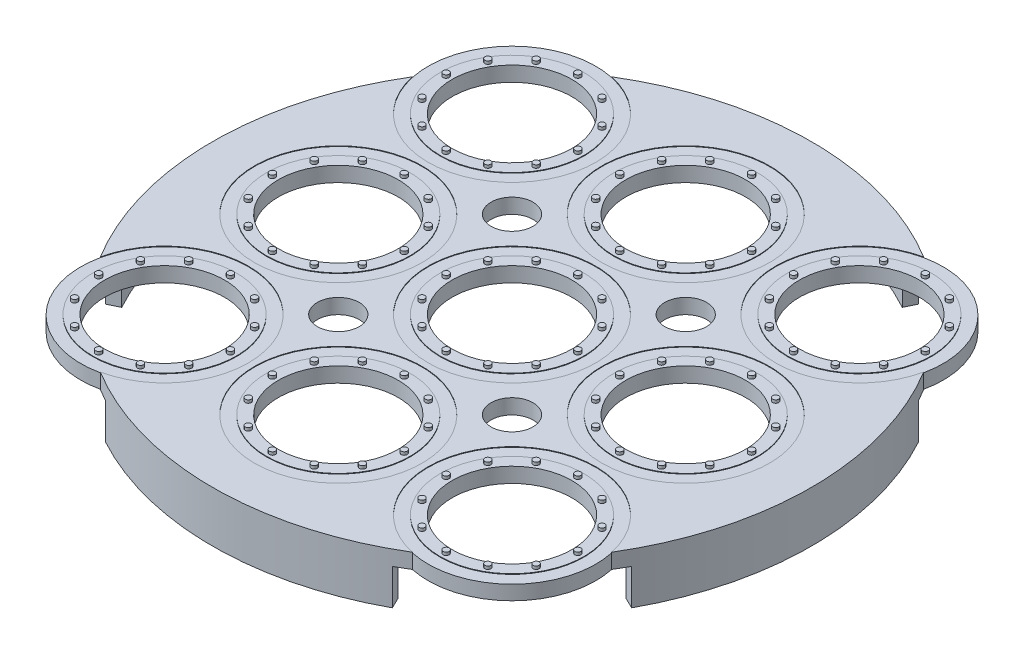
from build123d import *

# Parameters (mm, degrees)
BOSS_EXTRUDE1_DEPTH        = 2.5
SKETCH2_R                  = 10
CUT_EXTRUDE1_DEPTH         = 71.75485849
LPATTERN1_COUNT            = 3
LPATTERN1_PITCH            = 29
LPATTERN1_COUNT_DIR2       = 3
LPATTERN1_PITCH_DIR2       = 29
SKETCH4_R                  = 0.5
BOSS_EXTRUDE2_DEPTH        = 0.5
CIRPATTERN1_COUNT          = 12
LPATTERN2_COUNT            = 3
LPATTERN2_PITCH            = 29
LPATTERN2_COUNT_DIR2       = 3
LPATTERN2_PITCH_DIR2       = 29
LPATTERN2_COPY_1_SKETCH_R  = 0.5
LPATTERN2_COPY_1_DEPTH     = 0.5
LPATTERN2_COPY_2_SKETCH_R  = 0.5
LPATTERN2_COPY_2_DEPTH     = 0.5
LPATTERN2_COPY_3_SKETCH_R  = 0.5
LPATTERN2_COPY_3_DEPTH     = 0.5
LPATTERN2_COPY_4_SKETCH_R  = 0.5
LPATTERN2_COPY_4_DEPTH     = 0.5
LPATTERN2_COPY_5_SKETCH_R  = 0.5
LPATTERN2_COPY_5_DEPTH     = 0.5
LPATTERN2_COPY_6_SKETCH_R  = 0.5
LPATTERN2_COPY_6_DEPTH     = 0.5
LPATTERN2_COPY_7_SKETCH_R  = 0.5
LPATTERN2_COPY_7_DEPTH     = 0.5
LPATTERN2_COPY_8_SKETCH_R  = 0.5
LPATTERN2_COPY_8_DEPTH     = 0.5
LPATTERN2_COPY_9_SKETCH_R  = 0.5
LPATTERN2_COPY_9_DEPTH     = 0.5
LPATTERN2_COPY_10_SKETCH_R = 0.5
LPATTERN2_COPY_10_DEPTH    = 0.5
LPATTERN2_COPY_11_SKETCH_R = 0.5
LPATTERN2_COPY_11_DEPTH    = 0.5
LPATTERN2_COPY_12_SKETCH_R = 0.5
LPATTERN2_COPY_12_DEPTH    = 0.5
LPATTERN2_COPY_13_SKETCH_R = 0.5
LPATTERN2_COPY_13_DEPTH    = 0.5
LPATTERN2_COPY_14_SKETCH_R = 0.5
LPATTERN2_COPY_14_DEPTH    = 0.5
LPATTERN2_COPY_15_SKETCH_R = 0.5
LPATTERN2_COPY_15_DEPTH    = 0.5
LPATTERN2_COPY_16_SKETCH_R = 0.5
LPATTERN2_COPY_16_DEPTH    = 0.5
LPATTERN2_COPY_17_SKETCH_R = 0.5
LPATTERN2_COPY_17_DEPTH    = 0.5
LPATTERN2_COPY_18_SKETCH_R = 0.5
LPATTERN2_COPY_18_DEPTH    = 0.5
LPATTERN2_COPY_19_SKETCH_R = 0.5
LPATTERN2_COPY_19_DEPTH    = 0.5
LPATTERN2_COPY_20_SKETCH_R = 0.5
LPATTERN2_COPY_20_DEPTH    = 0.5
LPATTERN2_COPY_21_SKETCH_R = 0.5
LPATTERN2_COPY_21_DEPTH    = 0.5
LPATTERN2_COPY_22_SKETCH_R = 0.5
LPATTERN2_COPY_22_DEPTH    = 0.5
LPATTERN2_COPY_23_SKETCH_R = 0.5
LPATTERN2_COPY_23_DEPTH    = 0.5
LPATTERN2_COPY_24_SKETCH_R = 0.5
LPATTERN2_COPY_24_DEPTH    = 0.5
LPATTERN2_COPY_25_SKETCH_R = 0.5
LPATTERN2_COPY_25_DEPTH    = 0.5
LPATTERN2_COPY_26_SKETCH_R = 0.5
LPATTERN2_COPY_26_DEPTH    = 0.5
LPATTERN2_COPY_27_SKETCH_R = 0.5
LPATTERN2_COPY_27_DEPTH    = 0.5
LPATTERN2_COPY_28_SKETCH_R = 0.5
LPATTERN2_COPY_28_DEPTH    = 0.5
LPATTERN2_COPY_29_SKETCH_R = 0.5
LPATTERN2_COPY_29_DEPTH    = 0.5
LPATTERN2_COPY_30_SKETCH_R = 0.5
LPATTERN2_COPY_30_DEPTH    = 0.5
LPATTERN2_COPY_31_SKETCH_R = 0.5
LPATTERN2_COPY_31_DEPTH    = 0.5
LPATTERN2_COPY_32_SKETCH_R = 0.5
LPATTERN2_COPY_32_DEPTH    = 0.5
LPATTERN2_COPY_33_SKETCH_R = 0.5
LPATTERN2_COPY_33_DEPTH    = 0.5
LPATTERN2_COPY_34_SKETCH_R = 0.5
LPATTERN2_COPY_34_DEPTH    = 0.5
LPATTERN2_COPY_35_SKETCH_R = 0.5
LPATTERN2_COPY_35_DEPTH    = 0.5
LPATTERN2_COPY_36_SKETCH_R = 0.5
LPATTERN2_COPY_36_DEPTH    = 0.5
LPATTERN2_COPY_37_SKETCH_R = 0.5
LPATTERN2_COPY_37_DEPTH    = 0.5
LPATTERN2_COPY_38_SKETCH_R = 0.5
LPATTERN2_COPY_38_DEPTH    = 0.5
LPATTERN2_COPY_39_SKETCH_R = 0.5
LPATTERN2_COPY_39_DEPTH    = 0.5
LPATTERN2_COPY_40_SKETCH_R = 0.5
LPATTERN2_COPY_40_DEPTH    = 0.5
LPATTERN2_COPY_41_SKETCH_R = 0.5
LPATTERN2_COPY_41_DEPTH    = 0.5
LPATTERN2_COPY_42_SKETCH_R = 0.5
LPATTERN2_COPY_42_DEPTH    = 0.5
LPATTERN2_COPY_43_SKETCH_R = 0.5
LPATTERN2_COPY_43_DEPTH    = 0.5
LPATTERN2_COPY_44_SKETCH_R = 0.5
LPATTERN2_COPY_44_DEPTH    = 0.5
LPATTERN2_COPY_45_SKETCH_R = 0.5
LPATTERN2_COPY_45_DEPTH    = 0.5
LPATTERN2_COPY_46_SKETCH_R = 0.5
LPATTERN2_COPY_46_DEPTH    = 0.5
LPATTERN2_COPY_47_SKETCH_R = 0.5
LPATTERN2_COPY_47_DEPTH    = 0.5
LPATTERN2_COPY_48_SKETCH_R = 0.5
LPATTERN2_COPY_48_DEPTH    = 0.5
LPATTERN2_COPY_49_SKETCH_R = 0.5
LPATTERN2_COPY_49_DEPTH    = 0.5
LPATTERN2_COPY_50_SKETCH_R = 0.5
LPATTERN2_COPY_50_DEPTH    = 0.5
LPATTERN2_COPY_51_SKETCH_R = 0.5
LPATTERN2_COPY_51_DEPTH    = 0.5
LPATTERN2_COPY_52_SKETCH_R = 0.5
LPATTERN2_COPY_52_DEPTH    = 0.5
LPATTERN2_COPY_53_SKETCH_R = 0.5
LPATTERN2_COPY_53_DEPTH    = 0.5
LPATTERN2_COPY_54_SKETCH_R = 0.5
LPATTERN2_COPY_54_DEPTH    = 0.5
LPATTERN2_COPY_55_SKETCH_R = 0.5
LPATTERN2_COPY_55_DEPTH    = 0.5
LPATTERN2_COPY_56_SKETCH_R = 0.5
LPATTERN2_COPY_56_DEPTH    = 0.5
LPATTERN2_COPY_57_SKETCH_R = 0.5
LPATTERN2_COPY_57_DEPTH    = 0.5
LPATTERN2_COPY_58_SKETCH_R = 0.5
LPATTERN2_COPY_58_DEPTH    = 0.5
LPATTERN2_COPY_59_SKETCH_R = 0.5
LPATTERN2_COPY_59_DEPTH    = 0.5
LPATTERN2_COPY_60_SKETCH_R = 0.5
LPATTERN2_COPY_60_DEPTH    = 0.5
LPATTERN2_COPY_61_SKETCH_R = 0.5
LPATTERN2_COPY_61_DEPTH    = 0.5
LPATTERN2_COPY_62_SKETCH_R = 0.5
LPATTERN2_COPY_62_DEPTH    = 0.5
LPATTERN2_COPY_63_SKETCH_R = 0.5
LPATTERN2_COPY_63_DEPTH    = 0.5
LPATTERN2_COPY_64_SKETCH_R = 0.5
LPATTERN2_COPY_64_DEPTH    = 0.5
LPATTERN2_COPY_65_SKETCH_R = 0.5
LPATTERN2_COPY_65_DEPTH    = 0.5
LPATTERN2_COPY_66_SKETCH_R = 0.5
LPATTERN2_COPY_66_DEPTH    = 0.5
LPATTERN2_COPY_67_SKETCH_R = 0.5
LPATTERN2_COPY_67_DEPTH    = 0.5
LPATTERN2_COPY_68_SKETCH_R = 0.5
LPATTERN2_COPY_68_DEPTH    = 0.5
LPATTERN2_COPY_69_SKETCH_R = 0.5
LPATTERN2_COPY_69_DEPTH    = 0.5
LPATTERN2_COPY_70_SKETCH_R = 0.5
LPATTERN2_COPY_70_DEPTH    = 0.5
LPATTERN2_COPY_71_SKETCH_R = 0.5
LPATTERN2_COPY_71_DEPTH    = 0.5
LPATTERN2_COPY_72_SKETCH_R = 0.5
LPATTERN2_COPY_72_DEPTH    = 0.5
LPATTERN2_COPY_73_SKETCH_R = 0.5
LPATTERN2_COPY_73_DEPTH    = 0.5
LPATTERN2_COPY_74_SKETCH_R = 0.5
LPATTERN2_COPY_74_DEPTH    = 0.5
LPATTERN2_COPY_75_SKETCH_R = 0.5
LPATTERN2_COPY_75_DEPTH    = 0.5
LPATTERN2_COPY_76_SKETCH_R = 0.5
LPATTERN2_COPY_76_DEPTH    = 0.5
LPATTERN2_COPY_77_SKETCH_R = 0.5
LPATTERN2_COPY_77_DEPTH    = 0.5
LPATTERN2_COPY_78_SKETCH_R = 0.5
LPATTERN2_COPY_78_DEPTH    = 0.5
LPATTERN2_COPY_79_SKETCH_R = 0.5
LPATTERN2_COPY_79_DEPTH    = 0.5
LPATTERN2_COPY_80_SKETCH_R = 0.5
LPATTERN2_COPY_80_DEPTH    = 0.5
LPATTERN2_COPY_81_SKETCH_R = 0.5
LPATTERN2_COPY_81_DEPTH    = 0.5
LPATTERN2_COPY_82_SKETCH_R = 0.5
LPATTERN2_COPY_82_DEPTH    = 0.5
LPATTERN2_COPY_83_SKETCH_R = 0.5
LPATTERN2_COPY_83_DEPTH    = 0.5
LPATTERN2_COPY_84_SKETCH_R = 0.5
LPATTERN2_COPY_84_DEPTH    = 0.5
LPATTERN2_COPY_85_SKETCH_R = 0.5
LPATTERN2_COPY_85_DEPTH    = 0.5
LPATTERN2_COPY_86_SKETCH_R = 0.5
LPATTERN2_COPY_86_DEPTH    = 0.5
LPATTERN2_COPY_87_SKETCH_R = 0.5
LPATTERN2_COPY_87_DEPTH    = 0.5
LPATTERN2_COPY_88_SKETCH_R = 0.5
LPATTERN2_COPY_88_DEPTH    = 0.5
SKETCH5_R                  = 3.5
CUT_EXTRUDE2_DEPTH         = 71.75485849
MIRROR2_COPY_1_SKETCH_R    = 3.5
MIRROR2_COPY_1_DEPTH       = 71.75485849
BOSS_EXTRUDE3_START        = 6
BOSS_EXTRUDE3_DEPTH        = 6
CIRPATTERN2_COUNT          = 4
CUT_EXTRUDE3_START         = -0.1
SKETCH7_R                  = 14
SKETCH7_R_2                = 12
CUT_EXTRUDE3_DEPTH         = 0.1
LPATTERN3_COUNT            = 3
LPATTERN3_PITCH            = 29
LPATTERN3_COUNT_DIR2       = 3
LPATTERN3_PITCH_DIR2       = 29


with BuildPart() as part:
    # Sketch1 → Boss-Extrude1 (new body)
    with BuildSketch(Plane(origin=(0, 0, 0), x_dir=(1, 0, 0), z_dir=(0, 1, 0))):
        with BuildLine():
            ThreePointArc((26.040517643, 42.683620288), (0, 50), (-26.040517643, 42.683620288))
            ThreePointArc((-26.040517643, 42.683620288), (-38.899494937, 38.899494937), (-42.683620288, 26.040517643))
            ThreePointArc((-42.683620288, 26.040517643), (-50, 0), (-42.683620288, -26.040517643))
            ThreePointArc((-42.683620288, -26.040517643), (-38.899494937, -38.899494937), (-26.040517643, -42.683620288))
            ThreePointArc((-26.040517643, -42.683620288), (0, -50), (26.040517643, -42.683620288))
            ThreePointArc((26.040517643, -42.683620288), (38.899494937, -38.899494937), (42.683620288, -26.040517643))
            ThreePointArc((42.683620288, -26.040517643), (50, 0), (42.683620288, 26.040517643))
            ThreePointArc((42.683620288, 26.040517643), (38.899494937, 38.899494937), (26.040517643, 42.683620288))
        make_face()
    extrude(amount=BOSS_EXTRUDE1_DEPTH)

    # Sketch2 → Cut-Extrude1 (cut, through all)
    with BuildSketch(Plane(origin=(0, 2.5, 0), x_dir=(1, 0, 0), z_dir=(0, 1, 0))):
        with Locations(Location((-29, -29, 0), (0, 0, 270))):
            Circle(SKETCH2_R)
    cut_extrude1 = extrude(amount=-CUT_EXTRUDE1_DEPTH, mode=Mode.SUBTRACT)

    # LPattern1: Cut-Extrude1 3 × 3
    with Locations(*[(i * LPATTERN1_PITCH, 0, -j * LPATTERN1_PITCH_DIR2) for i in range(LPATTERN1_COUNT) for j in range(LPATTERN1_COUNT_DIR2) if (i, j) != (0, 0)]):
        add(cut_extrude1, mode=Mode.SUBTRACT)

    # Sketch4 → Boss-Extrude2 (add)
    with BuildSketch(Plane(origin=(0, 2.5, 0), x_dir=(1, 0, 0), z_dir=(0, 1, 0))):
        with Locations(Location((-29, -18, 0), (0, 0, 270))):
            Circle(SKETCH4_R)
    boss_extrude2 = extrude(amount=BOSS_EXTRUDE2_DEPTH)

    # CirPattern1: Boss-Extrude2 ×12 about axis
    cirpattern1_axis = Axis((-29, 0, 29), (0, 1, 0))
    for i in range(1, CIRPATTERN1_COUNT):
        add(boss_extrude2.rotate(cirpattern1_axis, i * 360 / CIRPATTERN1_COUNT))

    # LPattern2: Boss-Extrude2 3 × 3
    with Locations(*[(j * LPATTERN2_PITCH_DIR2, 0, -i * LPATTERN2_PITCH) for i in range(LPATTERN2_COUNT) for j in range(LPATTERN2_COUNT_DIR2) if (i, j) != (0, 0)]):
        add(boss_extrude2)

    # LPattern2 copy 1 sketch → LPattern2 copy 1 (add)
    with BuildSketch(Plane(origin=(10.61473671, 2.5, -10.61473671), x_dir=(0.8660254037844387, 0, -0.49999999999999994), z_dir=(0, 1, 0))):
        with Locations(Location((-29, -18, 0), (0, 0, 270))):
            Circle(LPATTERN2_COPY_1_SKETCH_R)
    extrude(amount=LPATTERN2_COPY_1_DEPTH)

    # LPattern2 copy 2 sketch → LPattern2 copy 2 (add)
    with BuildSketch(Plane(origin=(39.61473671, 2.5, -10.61473671), x_dir=(0.8660254037844387, 0, -0.49999999999999994), z_dir=(0, 1, 0))):
        with Locations(Location((-29, -18, 0), (0, 0, 270))):
            Circle(LPATTERN2_COPY_2_SKETCH_R)
    extrude(amount=LPATTERN2_COPY_2_DEPTH)

    # LPattern2 copy 3 sketch → LPattern2 copy 3 (add)
    with BuildSketch(Plane(origin=(-18.38526329, 2.5, -39.61473671), x_dir=(0.8660254037844387, 0, -0.49999999999999994), z_dir=(0, 1, 0))):
        with Locations(Location((-29, -18, 0), (0, 0, 270))):
            Circle(LPATTERN2_COPY_3_SKETCH_R)
    extrude(amount=LPATTERN2_COPY_3_DEPTH)

    # LPattern2 copy 4 sketch → LPattern2 copy 4 (add)
    with BuildSketch(Plane(origin=(10.61473671, 2.5, -39.61473671), x_dir=(0.8660254037844387, 0, -0.49999999999999994), z_dir=(0, 1, 0))):
        with Locations(Location((-29, -18, 0), (0, 0, 270))):
            Circle(LPATTERN2_COPY_4_SKETCH_R)
    extrude(amount=LPATTERN2_COPY_4_DEPTH)

    # LPattern2 copy 5 sketch → LPattern2 copy 5 (add)
    with BuildSketch(Plane(origin=(39.61473671, 2.5, -39.61473671), x_dir=(0.8660254037844387, 0, -0.49999999999999994), z_dir=(0, 1, 0))):
        with Locations(Location((-29, -18, 0), (0, 0, 270))):
            Circle(LPATTERN2_COPY_5_SKETCH_R)
    extrude(amount=LPATTERN2_COPY_5_DEPTH)

    # LPattern2 copy 6 sketch → LPattern2 copy 6 (add)
    with BuildSketch(Plane(origin=(-18.38526329, 2.5, -68.61473671), x_dir=(0.8660254037844387, 0, -0.49999999999999994), z_dir=(0, 1, 0))):
        with Locations(Location((-29, -18, 0), (0, 0, 270))):
            Circle(LPATTERN2_COPY_6_SKETCH_R)
    extrude(amount=LPATTERN2_COPY_6_DEPTH)

    # LPattern2 copy 7 sketch → LPattern2 copy 7 (add)
    with BuildSketch(Plane(origin=(10.61473671, 2.5, -68.61473671), x_dir=(0.8660254037844387, 0, -0.49999999999999994), z_dir=(0, 1, 0))):
        with Locations(Location((-29, -18, 0), (0, 0, 270))):
            Circle(LPATTERN2_COPY_7_SKETCH_R)
    extrude(amount=LPATTERN2_COPY_7_DEPTH)

    # LPattern2 copy 8 sketch → LPattern2 copy 8 (add)
    with BuildSketch(Plane(origin=(39.61473671, 2.5, -68.61473671), x_dir=(0.8660254037844387, 0, -0.49999999999999994), z_dir=(0, 1, 0))):
        with Locations(Location((-29, -18, 0), (0, 0, 270))):
            Circle(LPATTERN2_COPY_8_SKETCH_R)
    extrude(amount=LPATTERN2_COPY_8_DEPTH)

    # LPattern2 copy 9 sketch → LPattern2 copy 9 (add)
    with BuildSketch(Plane(origin=(-10.61473671, 2.5, -10.61473671), x_dir=(0.5000000000000001, 0, -0.8660254037844386), z_dir=(0, 1, 0))):
        with Locations(Location((-29, -18, 0), (0, 0, 270))):
            Circle(LPATTERN2_COPY_9_SKETCH_R)
    extrude(amount=LPATTERN2_COPY_9_DEPTH)

    # LPattern2 copy 10 sketch → LPattern2 copy 10 (add)
    with BuildSketch(Plane(origin=(18.38526329, 2.5, -10.61473671), x_dir=(0.5000000000000001, 0, -0.8660254037844386), z_dir=(0, 1, 0))):
        with Locations(Location((-29, -18, 0), (0, 0, 270))):
            Circle(LPATTERN2_COPY_10_SKETCH_R)
    extrude(amount=LPATTERN2_COPY_10_DEPTH)

    # LPattern2 copy 11 sketch → LPattern2 copy 11 (add)
    with BuildSketch(Plane(origin=(-39.61473671, 2.5, -39.61473671), x_dir=(0.5000000000000001, 0, -0.8660254037844386), z_dir=(0, 1, 0))):
        with Locations(Location((-29, -18, 0), (0, 0, 270))):
            Circle(LPATTERN2_COPY_11_SKETCH_R)
    extrude(amount=LPATTERN2_COPY_11_DEPTH)

    # LPattern2 copy 12 sketch → LPattern2 copy 12 (add)
    with BuildSketch(Plane(origin=(-10.61473671, 2.5, -39.61473671), x_dir=(0.5000000000000001, 0, -0.8660254037844386), z_dir=(0, 1, 0))):
        with Locations(Location((-29, -18, 0), (0, 0, 270))):
            Circle(LPATTERN2_COPY_12_SKETCH_R)
    extrude(amount=LPATTERN2_COPY_12_DEPTH)

    # LPattern2 copy 13 sketch → LPattern2 copy 13 (add)
    with BuildSketch(Plane(origin=(18.38526329, 2.5, -39.61473671), x_dir=(0.5000000000000001, 0, -0.8660254037844386), z_dir=(0, 1, 0))):
        with Locations(Location((-29, -18, 0), (0, 0, 270))):
            Circle(LPATTERN2_COPY_13_SKETCH_R)
    extrude(amount=LPATTERN2_COPY_13_DEPTH)

    # LPattern2 copy 14 sketch → LPattern2 copy 14 (add)
    with BuildSketch(Plane(origin=(-39.61473671, 2.5, -68.61473671), x_dir=(0.5000000000000001, 0, -0.8660254037844386), z_dir=(0, 1, 0))):
        with Locations(Location((-29, -18, 0), (0, 0, 270))):
            Circle(LPATTERN2_COPY_14_SKETCH_R)
    extrude(amount=LPATTERN2_COPY_14_DEPTH)

    # LPattern2 copy 15 sketch → LPattern2 copy 15 (add)
    with BuildSketch(Plane(origin=(-10.61473671, 2.5, -68.61473671), x_dir=(0.5000000000000001, 0, -0.8660254037844386), z_dir=(0, 1, 0))):
        with Locations(Location((-29, -18, 0), (0, 0, 270))):
            Circle(LPATTERN2_COPY_15_SKETCH_R)
    extrude(amount=LPATTERN2_COPY_15_DEPTH)

    # LPattern2 copy 16 sketch → LPattern2 copy 16 (add)
    with BuildSketch(Plane(origin=(18.38526329, 2.5, -68.61473671), x_dir=(0.5000000000000001, 0, -0.8660254037844386), z_dir=(0, 1, 0))):
        with Locations(Location((-29, -18, 0), (0, 0, 270))):
            Circle(LPATTERN2_COPY_16_SKETCH_R)
    extrude(amount=LPATTERN2_COPY_16_DEPTH)

    # LPattern2 copy 17 sketch → LPattern2 copy 17 (add)
    with BuildSketch(Plane(origin=(-29, 2.5, 0), x_dir=(0, 0, -1), z_dir=(0, 1, 0))):
        with Locations(Location((-29, -18, 0), (0, 0, 270))):
            Circle(LPATTERN2_COPY_17_SKETCH_R)
    extrude(amount=LPATTERN2_COPY_17_DEPTH)

    # LPattern2 copy 18 sketch → LPattern2 copy 18 (add)
    with BuildSketch(Plane(origin=(0, 2.5, 0), x_dir=(0, 0, -1), z_dir=(0, 1, 0))):
        with Locations(Location((-29, -18, 0), (0, 0, 270))):
            Circle(LPATTERN2_COPY_18_SKETCH_R)
    extrude(amount=LPATTERN2_COPY_18_DEPTH)

    # LPattern2 copy 19 sketch → LPattern2 copy 19 (add)
    with BuildSketch(Plane(origin=(-58, 2.5, -29), x_dir=(0, 0, -1), z_dir=(0, 1, 0))):
        with Locations(Location((-29, -18, 0), (0, 0, 270))):
            Circle(LPATTERN2_COPY_19_SKETCH_R)
    extrude(amount=LPATTERN2_COPY_19_DEPTH)

    # LPattern2 copy 20 sketch → LPattern2 copy 20 (add)
    with BuildSketch(Plane(origin=(-29, 2.5, -29), x_dir=(0, 0, -1), z_dir=(0, 1, 0))):
        with Locations(Location((-29, -18, 0), (0, 0, 270))):
            Circle(LPATTERN2_COPY_20_SKETCH_R)
    extrude(amount=LPATTERN2_COPY_20_DEPTH)

    # LPattern2 copy 21 sketch → LPattern2 copy 21 (add)
    with BuildSketch(Plane(origin=(0, 2.5, -29), x_dir=(0, 0, -1), z_dir=(0, 1, 0))):
        with Locations(Location((-29, -18, 0), (0, 0, 270))):
            Circle(LPATTERN2_COPY_21_SKETCH_R)
    extrude(amount=LPATTERN2_COPY_21_DEPTH)

    # LPattern2 copy 22 sketch → LPattern2 copy 22 (add)
    with BuildSketch(Plane(origin=(-58, 2.5, -58), x_dir=(0, 0, -1), z_dir=(0, 1, 0))):
        with Locations(Location((-29, -18, 0), (0, 0, 270))):
            Circle(LPATTERN2_COPY_22_SKETCH_R)
    extrude(amount=LPATTERN2_COPY_22_DEPTH)

    # LPattern2 copy 23 sketch → LPattern2 copy 23 (add)
    with BuildSketch(Plane(origin=(-29, 2.5, -58), x_dir=(0, 0, -1), z_dir=(0, 1, 0))):
        with Locations(Location((-29, -18, 0), (0, 0, 270))):
            Circle(LPATTERN2_COPY_23_SKETCH_R)
    extrude(amount=LPATTERN2_COPY_23_DEPTH)

    # LPattern2 copy 24 sketch → LPattern2 copy 24 (add)
    with BuildSketch(Plane(origin=(0, 2.5, -58), x_dir=(0, 0, -1), z_dir=(0, 1, 0))):
        with Locations(Location((-29, -18, 0), (0, 0, 270))):
            Circle(LPATTERN2_COPY_24_SKETCH_R)
    extrude(amount=LPATTERN2_COPY_24_DEPTH)

    # LPattern2 copy 25 sketch → LPattern2 copy 25 (add)
    with BuildSketch(Plane(origin=(-39.61473671, 2.5, 18.38526329), x_dir=(-0.4999999999999998, 0, -0.8660254037844387), z_dir=(0, 1, 0))):
        with Locations(Location((-29, -18, 0), (0, 0, 270))):
            Circle(LPATTERN2_COPY_25_SKETCH_R)
    extrude(amount=LPATTERN2_COPY_25_DEPTH)

    # LPattern2 copy 26 sketch → LPattern2 copy 26 (add)
    with BuildSketch(Plane(origin=(-10.61473671, 2.5, 18.38526329), x_dir=(-0.4999999999999998, 0, -0.8660254037844387), z_dir=(0, 1, 0))):
        with Locations(Location((-29, -18, 0), (0, 0, 270))):
            Circle(LPATTERN2_COPY_26_SKETCH_R)
    extrude(amount=LPATTERN2_COPY_26_DEPTH)

    # LPattern2 copy 27 sketch → LPattern2 copy 27 (add)
    with BuildSketch(Plane(origin=(-68.61473671, 2.5, -10.61473671), x_dir=(-0.4999999999999998, 0, -0.8660254037844387), z_dir=(0, 1, 0))):
        with Locations(Location((-29, -18, 0), (0, 0, 270))):
            Circle(LPATTERN2_COPY_27_SKETCH_R)
    extrude(amount=LPATTERN2_COPY_27_DEPTH)

    # LPattern2 copy 28 sketch → LPattern2 copy 28 (add)
    with BuildSketch(Plane(origin=(-39.61473671, 2.5, -10.61473671), x_dir=(-0.4999999999999998, 0, -0.8660254037844387), z_dir=(0, 1, 0))):
        with Locations(Location((-29, -18, 0), (0, 0, 270))):
            Circle(LPATTERN2_COPY_28_SKETCH_R)
    extrude(amount=LPATTERN2_COPY_28_DEPTH)

    # LPattern2 copy 29 sketch → LPattern2 copy 29 (add)
    with BuildSketch(Plane(origin=(-10.61473671, 2.5, -10.61473671), x_dir=(-0.4999999999999998, 0, -0.8660254037844387), z_dir=(0, 1, 0))):
        with Locations(Location((-29, -18, 0), (0, 0, 270))):
            Circle(LPATTERN2_COPY_29_SKETCH_R)
    extrude(amount=LPATTERN2_COPY_29_DEPTH)

    # LPattern2 copy 30 sketch → LPattern2 copy 30 (add)
    with BuildSketch(Plane(origin=(-68.61473671, 2.5, -39.61473671), x_dir=(-0.4999999999999998, 0, -0.8660254037844387), z_dir=(0, 1, 0))):
        with Locations(Location((-29, -18, 0), (0, 0, 270))):
            Circle(LPATTERN2_COPY_30_SKETCH_R)
    extrude(amount=LPATTERN2_COPY_30_DEPTH)

    # LPattern2 copy 31 sketch → LPattern2 copy 31 (add)
    with BuildSketch(Plane(origin=(-39.61473671, 2.5, -39.61473671), x_dir=(-0.4999999999999998, 0, -0.8660254037844387), z_dir=(0, 1, 0))):
        with Locations(Location((-29, -18, 0), (0, 0, 270))):
            Circle(LPATTERN2_COPY_31_SKETCH_R)
    extrude(amount=LPATTERN2_COPY_31_DEPTH)

    # LPattern2 copy 32 sketch → LPattern2 copy 32 (add)
    with BuildSketch(Plane(origin=(-10.61473671, 2.5, -39.61473671), x_dir=(-0.4999999999999998, 0, -0.8660254037844387), z_dir=(0, 1, 0))):
        with Locations(Location((-29, -18, 0), (0, 0, 270))):
            Circle(LPATTERN2_COPY_32_SKETCH_R)
    extrude(amount=LPATTERN2_COPY_32_DEPTH)

    # LPattern2 copy 33 sketch → LPattern2 copy 33 (add)
    with BuildSketch(Plane(origin=(-39.61473671, 2.5, 39.61473671), x_dir=(-0.8660254037844387, 0, -0.49999999999999994), z_dir=(0, 1, 0))):
        with Locations(Location((-29, -18, 0), (0, 0, 270))):
            Circle(LPATTERN2_COPY_33_SKETCH_R)
    extrude(amount=LPATTERN2_COPY_33_DEPTH)

    # LPattern2 copy 34 sketch → LPattern2 copy 34 (add)
    with BuildSketch(Plane(origin=(-10.61473671, 2.5, 39.61473671), x_dir=(-0.8660254037844387, 0, -0.49999999999999994), z_dir=(0, 1, 0))):
        with Locations(Location((-29, -18, 0), (0, 0, 270))):
            Circle(LPATTERN2_COPY_34_SKETCH_R)
    extrude(amount=LPATTERN2_COPY_34_DEPTH)

    # LPattern2 copy 35 sketch → LPattern2 copy 35 (add)
    with BuildSketch(Plane(origin=(-68.61473671, 2.5, 10.61473671), x_dir=(-0.8660254037844387, 0, -0.49999999999999994), z_dir=(0, 1, 0))):
        with Locations(Location((-29, -18, 0), (0, 0, 270))):
            Circle(LPATTERN2_COPY_35_SKETCH_R)
    extrude(amount=LPATTERN2_COPY_35_DEPTH)

    # LPattern2 copy 36 sketch → LPattern2 copy 36 (add)
    with BuildSketch(Plane(origin=(-39.61473671, 2.5, 10.61473671), x_dir=(-0.8660254037844387, 0, -0.49999999999999994), z_dir=(0, 1, 0))):
        with Locations(Location((-29, -18, 0), (0, 0, 270))):
            Circle(LPATTERN2_COPY_36_SKETCH_R)
    extrude(amount=LPATTERN2_COPY_36_DEPTH)

    # LPattern2 copy 37 sketch → LPattern2 copy 37 (add)
    with BuildSketch(Plane(origin=(-10.61473671, 2.5, 10.61473671), x_dir=(-0.8660254037844387, 0, -0.49999999999999994), z_dir=(0, 1, 0))):
        with Locations(Location((-29, -18, 0), (0, 0, 270))):
            Circle(LPATTERN2_COPY_37_SKETCH_R)
    extrude(amount=LPATTERN2_COPY_37_DEPTH)

    # LPattern2 copy 38 sketch → LPattern2 copy 38 (add)
    with BuildSketch(Plane(origin=(-68.61473671, 2.5, -18.38526329), x_dir=(-0.8660254037844387, 0, -0.49999999999999994), z_dir=(0, 1, 0))):
        with Locations(Location((-29, -18, 0), (0, 0, 270))):
            Circle(LPATTERN2_COPY_38_SKETCH_R)
    extrude(amount=LPATTERN2_COPY_38_DEPTH)

    # LPattern2 copy 39 sketch → LPattern2 copy 39 (add)
    with BuildSketch(Plane(origin=(-39.61473671, 2.5, -18.38526329), x_dir=(-0.8660254037844387, 0, -0.49999999999999994), z_dir=(0, 1, 0))):
        with Locations(Location((-29, -18, 0), (0, 0, 270))):
            Circle(LPATTERN2_COPY_39_SKETCH_R)
    extrude(amount=LPATTERN2_COPY_39_DEPTH)

    # LPattern2 copy 40 sketch → LPattern2 copy 40 (add)
    with BuildSketch(Plane(origin=(-10.61473671, 2.5, -18.38526329), x_dir=(-0.8660254037844387, 0, -0.49999999999999994), z_dir=(0, 1, 0))):
        with Locations(Location((-29, -18, 0), (0, 0, 270))):
            Circle(LPATTERN2_COPY_40_SKETCH_R)
    extrude(amount=LPATTERN2_COPY_40_DEPTH)

    # LPattern2 copy 41 sketch → LPattern2 copy 41 (add)
    with BuildSketch(Plane(origin=(-29, 2.5, 58), x_dir=(-1, 0, 0), z_dir=(0, 1, 0))):
        with Locations(Location((-29, -18, 0), (0, 0, 270))):
            Circle(LPATTERN2_COPY_41_SKETCH_R)
    extrude(amount=LPATTERN2_COPY_41_DEPTH)

    # LPattern2 copy 42 sketch → LPattern2 copy 42 (add)
    with BuildSketch(Plane(origin=(0, 2.5, 58), x_dir=(-1, 0, 0), z_dir=(0, 1, 0))):
        with Locations(Location((-29, -18, 0), (0, 0, 270))):
            Circle(LPATTERN2_COPY_42_SKETCH_R)
    extrude(amount=LPATTERN2_COPY_42_DEPTH)

    # LPattern2 copy 43 sketch → LPattern2 copy 43 (add)
    with BuildSketch(Plane(origin=(-58, 2.5, 29), x_dir=(-1, 0, 0), z_dir=(0, 1, 0))):
        with Locations(Location((-29, -18, 0), (0, 0, 270))):
            Circle(LPATTERN2_COPY_43_SKETCH_R)
    extrude(amount=LPATTERN2_COPY_43_DEPTH)

    # LPattern2 copy 44 sketch → LPattern2 copy 44 (add)
    with BuildSketch(Plane(origin=(-29, 2.5, 29), x_dir=(-1, 0, 0), z_dir=(0, 1, 0))):
        with Locations(Location((-29, -18, 0), (0, 0, 270))):
            Circle(LPATTERN2_COPY_44_SKETCH_R)
    extrude(amount=LPATTERN2_COPY_44_DEPTH)

    # LPattern2 copy 45 sketch → LPattern2 copy 45 (add)
    with BuildSketch(Plane(origin=(0, 2.5, 29), x_dir=(-1, 0, 0), z_dir=(0, 1, 0))):
        with Locations(Location((-29, -18, 0), (0, 0, 270))):
            Circle(LPATTERN2_COPY_45_SKETCH_R)
    extrude(amount=LPATTERN2_COPY_45_DEPTH)

    # LPattern2 copy 46 sketch → LPattern2 copy 46 (add)
    with BuildSketch(Plane(origin=(-58, 2.5, 0), x_dir=(-1, 0, 0), z_dir=(0, 1, 0))):
        with Locations(Location((-29, -18, 0), (0, 0, 270))):
            Circle(LPATTERN2_COPY_46_SKETCH_R)
    extrude(amount=LPATTERN2_COPY_46_DEPTH)

    # LPattern2 copy 47 sketch → LPattern2 copy 47 (add)
    with BuildSketch(Plane(origin=(-29, 2.5, 0), x_dir=(-1, 0, 0), z_dir=(0, 1, 0))):
        with Locations(Location((-29, -18, 0), (0, 0, 270))):
            Circle(LPATTERN2_COPY_47_SKETCH_R)
    extrude(amount=LPATTERN2_COPY_47_DEPTH)

    # LPattern2 copy 48 sketch → LPattern2 copy 48 (add)
    with BuildSketch(Plane(origin=(0, 2.5, 0), x_dir=(-1, 0, 0), z_dir=(0, 1, 0))):
        with Locations(Location((-29, -18, 0), (0, 0, 270))):
            Circle(LPATTERN2_COPY_48_SKETCH_R)
    extrude(amount=LPATTERN2_COPY_48_DEPTH)

    # LPattern2 copy 49 sketch → LPattern2 copy 49 (add)
    with BuildSketch(Plane(origin=(-10.61473671, 2.5, 68.61473671), x_dir=(-0.8660254037844386, 0, 0.5000000000000001), z_dir=(0, 1, 0))):
        with Locations(Location((-29, -18, 0), (0, 0, 270))):
            Circle(LPATTERN2_COPY_49_SKETCH_R)
    extrude(amount=LPATTERN2_COPY_49_DEPTH)

    # LPattern2 copy 50 sketch → LPattern2 copy 50 (add)
    with BuildSketch(Plane(origin=(18.38526329, 2.5, 68.61473671), x_dir=(-0.8660254037844386, 0, 0.5000000000000001), z_dir=(0, 1, 0))):
        with Locations(Location((-29, -18, 0), (0, 0, 270))):
            Circle(LPATTERN2_COPY_50_SKETCH_R)
    extrude(amount=LPATTERN2_COPY_50_DEPTH)

    # LPattern2 copy 51 sketch → LPattern2 copy 51 (add)
    with BuildSketch(Plane(origin=(-39.61473671, 2.5, 39.61473671), x_dir=(-0.8660254037844386, 0, 0.5000000000000001), z_dir=(0, 1, 0))):
        with Locations(Location((-29, -18, 0), (0, 0, 270))):
            Circle(LPATTERN2_COPY_51_SKETCH_R)
    extrude(amount=LPATTERN2_COPY_51_DEPTH)

    # LPattern2 copy 52 sketch → LPattern2 copy 52 (add)
    with BuildSketch(Plane(origin=(-10.61473671, 2.5, 39.61473671), x_dir=(-0.8660254037844386, 0, 0.5000000000000001), z_dir=(0, 1, 0))):
        with Locations(Location((-29, -18, 0), (0, 0, 270))):
            Circle(LPATTERN2_COPY_52_SKETCH_R)
    extrude(amount=LPATTERN2_COPY_52_DEPTH)

    # LPattern2 copy 53 sketch → LPattern2 copy 53 (add)
    with BuildSketch(Plane(origin=(18.38526329, 2.5, 39.61473671), x_dir=(-0.8660254037844386, 0, 0.5000000000000001), z_dir=(0, 1, 0))):
        with Locations(Location((-29, -18, 0), (0, 0, 270))):
            Circle(LPATTERN2_COPY_53_SKETCH_R)
    extrude(amount=LPATTERN2_COPY_53_DEPTH)

    # LPattern2 copy 54 sketch → LPattern2 copy 54 (add)
    with BuildSketch(Plane(origin=(-39.61473671, 2.5, 10.61473671), x_dir=(-0.8660254037844386, 0, 0.5000000000000001), z_dir=(0, 1, 0))):
        with Locations(Location((-29, -18, 0), (0, 0, 270))):
            Circle(LPATTERN2_COPY_54_SKETCH_R)
    extrude(amount=LPATTERN2_COPY_54_DEPTH)

    # LPattern2 copy 55 sketch → LPattern2 copy 55 (add)
    with BuildSketch(Plane(origin=(-10.61473671, 2.5, 10.61473671), x_dir=(-0.8660254037844386, 0, 0.5000000000000001), z_dir=(0, 1, 0))):
        with Locations(Location((-29, -18, 0), (0, 0, 270))):
            Circle(LPATTERN2_COPY_55_SKETCH_R)
    extrude(amount=LPATTERN2_COPY_55_DEPTH)

    # LPattern2 copy 56 sketch → LPattern2 copy 56 (add)
    with BuildSketch(Plane(origin=(18.38526329, 2.5, 10.61473671), x_dir=(-0.8660254037844386, 0, 0.5000000000000001), z_dir=(0, 1, 0))):
        with Locations(Location((-29, -18, 0), (0, 0, 270))):
            Circle(LPATTERN2_COPY_56_SKETCH_R)
    extrude(amount=LPATTERN2_COPY_56_DEPTH)

    # LPattern2 copy 57 sketch → LPattern2 copy 57 (add)
    with BuildSketch(Plane(origin=(10.61473671, 2.5, 68.61473671), x_dir=(-0.5000000000000004, 0, 0.8660254037844384), z_dir=(0, 1, 0))):
        with Locations(Location((-29, -18, 0), (0, 0, 270))):
            Circle(LPATTERN2_COPY_57_SKETCH_R)
    extrude(amount=LPATTERN2_COPY_57_DEPTH)

    # LPattern2 copy 58 sketch → LPattern2 copy 58 (add)
    with BuildSketch(Plane(origin=(39.61473671, 2.5, 68.61473671), x_dir=(-0.5000000000000004, 0, 0.8660254037844384), z_dir=(0, 1, 0))):
        with Locations(Location((-29, -18, 0), (0, 0, 270))):
            Circle(LPATTERN2_COPY_58_SKETCH_R)
    extrude(amount=LPATTERN2_COPY_58_DEPTH)

    # LPattern2 copy 59 sketch → LPattern2 copy 59 (add)
    with BuildSketch(Plane(origin=(-18.38526329, 2.5, 39.61473671), x_dir=(-0.5000000000000004, 0, 0.8660254037844384), z_dir=(0, 1, 0))):
        with Locations(Location((-29, -18, 0), (0, 0, 270))):
            Circle(LPATTERN2_COPY_59_SKETCH_R)
    extrude(amount=LPATTERN2_COPY_59_DEPTH)

    # LPattern2 copy 60 sketch → LPattern2 copy 60 (add)
    with BuildSketch(Plane(origin=(10.61473671, 2.5, 39.61473671), x_dir=(-0.5000000000000004, 0, 0.8660254037844384), z_dir=(0, 1, 0))):
        with Locations(Location((-29, -18, 0), (0, 0, 270))):
            Circle(LPATTERN2_COPY_60_SKETCH_R)
    extrude(amount=LPATTERN2_COPY_60_DEPTH)

    # LPattern2 copy 61 sketch → LPattern2 copy 61 (add)
    with BuildSketch(Plane(origin=(39.61473671, 2.5, 39.61473671), x_dir=(-0.5000000000000004, 0, 0.8660254037844384), z_dir=(0, 1, 0))):
        with Locations(Location((-29, -18, 0), (0, 0, 270))):
            Circle(LPATTERN2_COPY_61_SKETCH_R)
    extrude(amount=LPATTERN2_COPY_61_DEPTH)

    # LPattern2 copy 62 sketch → LPattern2 copy 62 (add)
    with BuildSketch(Plane(origin=(-18.38526329, 2.5, 10.61473671), x_dir=(-0.5000000000000004, 0, 0.8660254037844384), z_dir=(0, 1, 0))):
        with Locations(Location((-29, -18, 0), (0, 0, 270))):
            Circle(LPATTERN2_COPY_62_SKETCH_R)
    extrude(amount=LPATTERN2_COPY_62_DEPTH)

    # LPattern2 copy 63 sketch → LPattern2 copy 63 (add)
    with BuildSketch(Plane(origin=(10.61473671, 2.5, 10.61473671), x_dir=(-0.5000000000000004, 0, 0.8660254037844384), z_dir=(0, 1, 0))):
        with Locations(Location((-29, -18, 0), (0, 0, 270))):
            Circle(LPATTERN2_COPY_63_SKETCH_R)
    extrude(amount=LPATTERN2_COPY_63_DEPTH)

    # LPattern2 copy 64 sketch → LPattern2 copy 64 (add)
    with BuildSketch(Plane(origin=(39.61473671, 2.5, 10.61473671), x_dir=(-0.5000000000000004, 0, 0.8660254037844384), z_dir=(0, 1, 0))):
        with Locations(Location((-29, -18, 0), (0, 0, 270))):
            Circle(LPATTERN2_COPY_64_SKETCH_R)
    extrude(amount=LPATTERN2_COPY_64_DEPTH)

    # LPattern2 copy 65 sketch → LPattern2 copy 65 (add)
    with BuildSketch(Plane(origin=(29, 2.5, 58), x_dir=(0, 0, 1), z_dir=(0, 1, 0))):
        with Locations(Location((-29, -18, 0), (0, 0, 270))):
            Circle(LPATTERN2_COPY_65_SKETCH_R)
    extrude(amount=LPATTERN2_COPY_65_DEPTH)

    # LPattern2 copy 66 sketch → LPattern2 copy 66 (add)
    with BuildSketch(Plane(origin=(58, 2.5, 58), x_dir=(0, 0, 1), z_dir=(0, 1, 0))):
        with Locations(Location((-29, -18, 0), (0, 0, 270))):
            Circle(LPATTERN2_COPY_66_SKETCH_R)
    extrude(amount=LPATTERN2_COPY_66_DEPTH)

    # LPattern2 copy 67 sketch → LPattern2 copy 67 (add)
    with BuildSketch(Plane(origin=(0, 2.5, 29), x_dir=(0, 0, 1), z_dir=(0, 1, 0))):
        with Locations(Location((-29, -18, 0), (0, 0, 270))):
            Circle(LPATTERN2_COPY_67_SKETCH_R)
    extrude(amount=LPATTERN2_COPY_67_DEPTH)

    # LPattern2 copy 68 sketch → LPattern2 copy 68 (add)
    with BuildSketch(Plane(origin=(29, 2.5, 29), x_dir=(0, 0, 1), z_dir=(0, 1, 0))):
        with Locations(Location((-29, -18, 0), (0, 0, 270))):
            Circle(LPATTERN2_COPY_68_SKETCH_R)
    extrude(amount=LPATTERN2_COPY_68_DEPTH)

    # LPattern2 copy 69 sketch → LPattern2 copy 69 (add)
    with BuildSketch(Plane(origin=(58, 2.5, 29), x_dir=(0, 0, 1), z_dir=(0, 1, 0))):
        with Locations(Location((-29, -18, 0), (0, 0, 270))):
            Circle(LPATTERN2_COPY_69_SKETCH_R)
    extrude(amount=LPATTERN2_COPY_69_DEPTH)

    # LPattern2 copy 70 sketch → LPattern2 copy 70 (add)
    with BuildSketch(Plane.ZX.offset(2.5)):
        with Locations(Location((-29, -18, 0), (0, 0, 270))):
            Circle(LPATTERN2_COPY_70_SKETCH_R)
    extrude(amount=LPATTERN2_COPY_70_DEPTH)

    # LPattern2 copy 71 sketch → LPattern2 copy 71 (add)
    with BuildSketch(Plane(origin=(29, 2.5, 0), x_dir=(0, 0, 1), z_dir=(0, 1, 0))):
        with Locations(Location((-29, -18, 0), (0, 0, 270))):
            Circle(LPATTERN2_COPY_71_SKETCH_R)
    extrude(amount=LPATTERN2_COPY_71_DEPTH)

    # LPattern2 copy 72 sketch → LPattern2 copy 72 (add)
    with BuildSketch(Plane(origin=(58, 2.5, 0), x_dir=(0, 0, 1), z_dir=(0, 1, 0))):
        with Locations(Location((-29, -18, 0), (0, 0, 270))):
            Circle(LPATTERN2_COPY_72_SKETCH_R)
    extrude(amount=LPATTERN2_COPY_72_DEPTH)

    # LPattern2 copy 73 sketch → LPattern2 copy 73 (add)
    with BuildSketch(Plane(origin=(39.61473671, 2.5, 39.61473671), x_dir=(0.5000000000000001, 0, 0.8660254037844386), z_dir=(0, 1, 0))):
        with Locations(Location((-29, -18, 0), (0, 0, 270))):
            Circle(LPATTERN2_COPY_73_SKETCH_R)
    extrude(amount=LPATTERN2_COPY_73_DEPTH)

    # LPattern2 copy 74 sketch → LPattern2 copy 74 (add)
    with BuildSketch(Plane(origin=(68.61473671, 2.5, 39.61473671), x_dir=(0.5000000000000001, 0, 0.8660254037844386), z_dir=(0, 1, 0))):
        with Locations(Location((-29, -18, 0), (0, 0, 270))):
            Circle(LPATTERN2_COPY_74_SKETCH_R)
    extrude(amount=LPATTERN2_COPY_74_DEPTH)

    # LPattern2 copy 75 sketch → LPattern2 copy 75 (add)
    with BuildSketch(Plane(origin=(10.61473671, 2.5, 10.61473671), x_dir=(0.5000000000000001, 0, 0.8660254037844386), z_dir=(0, 1, 0))):
        with Locations(Location((-29, -18, 0), (0, 0, 270))):
            Circle(LPATTERN2_COPY_75_SKETCH_R)
    extrude(amount=LPATTERN2_COPY_75_DEPTH)

    # LPattern2 copy 76 sketch → LPattern2 copy 76 (add)
    with BuildSketch(Plane(origin=(39.61473671, 2.5, 10.61473671), x_dir=(0.5000000000000001, 0, 0.8660254037844386), z_dir=(0, 1, 0))):
        with Locations(Location((-29, -18, 0), (0, 0, 270))):
            Circle(LPATTERN2_COPY_76_SKETCH_R)
    extrude(amount=LPATTERN2_COPY_76_DEPTH)

    # LPattern2 copy 77 sketch → LPattern2 copy 77 (add)
    with BuildSketch(Plane(origin=(68.61473671, 2.5, 10.61473671), x_dir=(0.5000000000000001, 0, 0.8660254037844386), z_dir=(0, 1, 0))):
        with Locations(Location((-29, -18, 0), (0, 0, 270))):
            Circle(LPATTERN2_COPY_77_SKETCH_R)
    extrude(amount=LPATTERN2_COPY_77_DEPTH)

    # LPattern2 copy 78 sketch → LPattern2 copy 78 (add)
    with BuildSketch(Plane(origin=(10.61473671, 2.5, -18.38526329), x_dir=(0.5000000000000001, 0, 0.8660254037844386), z_dir=(0, 1, 0))):
        with Locations(Location((-29, -18, 0), (0, 0, 270))):
            Circle(LPATTERN2_COPY_78_SKETCH_R)
    extrude(amount=LPATTERN2_COPY_78_DEPTH)

    # LPattern2 copy 79 sketch → LPattern2 copy 79 (add)
    with BuildSketch(Plane(origin=(39.61473671, 2.5, -18.38526329), x_dir=(0.5000000000000001, 0, 0.8660254037844386), z_dir=(0, 1, 0))):
        with Locations(Location((-29, -18, 0), (0, 0, 270))):
            Circle(LPATTERN2_COPY_79_SKETCH_R)
    extrude(amount=LPATTERN2_COPY_79_DEPTH)

    # LPattern2 copy 80 sketch → LPattern2 copy 80 (add)
    with BuildSketch(Plane(origin=(68.61473671, 2.5, -18.38526329), x_dir=(0.5000000000000001, 0, 0.8660254037844386), z_dir=(0, 1, 0))):
        with Locations(Location((-29, -18, 0), (0, 0, 270))):
            Circle(LPATTERN2_COPY_80_SKETCH_R)
    extrude(amount=LPATTERN2_COPY_80_DEPTH)

    # LPattern2 copy 81 sketch → LPattern2 copy 81 (add)
    with BuildSketch(Plane(origin=(39.61473671, 2.5, 18.38526329), x_dir=(0.8660254037844384, 0, 0.5000000000000004), z_dir=(0, 1, 0))):
        with Locations(Location((-29, -18, 0), (0, 0, 270))):
            Circle(LPATTERN2_COPY_81_SKETCH_R)
    extrude(amount=LPATTERN2_COPY_81_DEPTH)

    # LPattern2 copy 82 sketch → LPattern2 copy 82 (add)
    with BuildSketch(Plane(origin=(68.61473671, 2.5, 18.38526329), x_dir=(0.8660254037844384, 0, 0.5000000000000004), z_dir=(0, 1, 0))):
        with Locations(Location((-29, -18, 0), (0, 0, 270))):
            Circle(LPATTERN2_COPY_82_SKETCH_R)
    extrude(amount=LPATTERN2_COPY_82_DEPTH)

    # LPattern2 copy 83 sketch → LPattern2 copy 83 (add)
    with BuildSketch(Plane(origin=(10.61473671, 2.5, -10.61473671), x_dir=(0.8660254037844384, 0, 0.5000000000000004), z_dir=(0, 1, 0))):
        with Locations(Location((-29, -18, 0), (0, 0, 270))):
            Circle(LPATTERN2_COPY_83_SKETCH_R)
    extrude(amount=LPATTERN2_COPY_83_DEPTH)

    # LPattern2 copy 84 sketch → LPattern2 copy 84 (add)
    with BuildSketch(Plane(origin=(39.61473671, 2.5, -10.61473671), x_dir=(0.8660254037844384, 0, 0.5000000000000004), z_dir=(0, 1, 0))):
        with Locations(Location((-29, -18, 0), (0, 0, 270))):
            Circle(LPATTERN2_COPY_84_SKETCH_R)
    extrude(amount=LPATTERN2_COPY_84_DEPTH)

    # LPattern2 copy 85 sketch → LPattern2 copy 85 (add)
    with BuildSketch(Plane(origin=(68.61473671, 2.5, -10.61473671), x_dir=(0.8660254037844384, 0, 0.5000000000000004), z_dir=(0, 1, 0))):
        with Locations(Location((-29, -18, 0), (0, 0, 270))):
            Circle(LPATTERN2_COPY_85_SKETCH_R)
    extrude(amount=LPATTERN2_COPY_85_DEPTH)

    # LPattern2 copy 86 sketch → LPattern2 copy 86 (add)
    with BuildSketch(Plane(origin=(10.61473671, 2.5, -39.61473671), x_dir=(0.8660254037844384, 0, 0.5000000000000004), z_dir=(0, 1, 0))):
        with Locations(Location((-29, -18, 0), (0, 0, 270))):
            Circle(LPATTERN2_COPY_86_SKETCH_R)
    extrude(amount=LPATTERN2_COPY_86_DEPTH)

    # LPattern2 copy 87 sketch → LPattern2 copy 87 (add)
    with BuildSketch(Plane(origin=(39.61473671, 2.5, -39.61473671), x_dir=(0.8660254037844384, 0, 0.5000000000000004), z_dir=(0, 1, 0))):
        with Locations(Location((-29, -18, 0), (0, 0, 270))):
            Circle(LPATTERN2_COPY_87_SKETCH_R)
    extrude(amount=LPATTERN2_COPY_87_DEPTH)

    # LPattern2 copy 88 sketch → LPattern2 copy 88 (add)
    with BuildSketch(Plane(origin=(68.61473671, 2.5, -39.61473671), x_dir=(0.8660254037844384, 0, 0.5000000000000004), z_dir=(0, 1, 0))):
        with Locations(Location((-29, -18, 0), (0, 0, 270))):
            Circle(LPATTERN2_COPY_88_SKETCH_R)
    extrude(amount=LPATTERN2_COPY_88_DEPTH)

    # Sketch5 → Cut-Extrude2 (cut, through all)
    with BuildSketch(Plane(origin=(0, 2.5, 0), x_dir=(1, 0, 0), z_dir=(0, 1, 0))):
        with Locations(Location((14.5, -14.5, 0), (0, 0, 270))):
            Circle(SKETCH5_R)
    cut_extrude2 = extrude(amount=-CUT_EXTRUDE2_DEPTH, mode=Mode.SUBTRACT)

    # Mirror1: Cut-Extrude2 across plane
    add(cut_extrude2.mirror(Plane(origin=(0, 0, 0), x_dir=(0, 0, 1), z_dir=(1, 0, 0))), mode=Mode.SUBTRACT)

    # Mirror2: Cut-Extrude2 across plane
    add(cut_extrude2.mirror(Plane.XY), mode=Mode.SUBTRACT)

    # Mirror2 copy 1 sketch → Mirror2 copy 1 (cut, through all)
    with BuildSketch(Plane(origin=(0, 2.5, 0), x_dir=(-1, 0, 0), z_dir=(0, 1, 0))):
        with Locations(Location((14.5, -14.5, 0), (0, 0, 270))):
            Circle(MIRROR2_COPY_1_SKETCH_R)
    extrude(amount=-MIRROR2_COPY_1_DEPTH, mode=Mode.SUBTRACT)

    # Sketch6 → Boss-Extrude3 (add)
    with BuildSketch(Plane(origin=(0, 0, 0), x_dir=(-1, 0, 0), z_dir=(0, -1, 0)).offset(BOSS_EXTRUDE3_START)):
        with BuildLine():
            Line((-23.924558642, -43.904618137), (-23.047816349, -42.107030045))
            ThreePointArc((-23.047816349, -42.107030045), (0, -48.002123053), (23.047816349, -42.107030045))
            Line((23.047816349, -42.107030045), (23.924558642, -43.904618137))
            ThreePointArc((23.924558642, -43.904618137), (0, -50), (-23.924558642, -43.904618137))
        make_face()
    boss_extrude3 = extrude(amount=-BOSS_EXTRUDE3_DEPTH)

    # CirPattern2: Boss-Extrude3 ×4 about axis
    cirpattern2_axis = Axis((0, 0, 0), (0, 1, 0))
    for i in range(1, CIRPATTERN2_COUNT):
        add(boss_extrude3.rotate(cirpattern2_axis, i * 360 / CIRPATTERN2_COUNT))

    # Sketch7 → Cut-Extrude3 (cut)
    with BuildSketch(Plane(origin=(0, 2.5, 0), x_dir=(1, 0, 0), z_dir=(0, 1, 0)).offset(CUT_EXTRUDE3_START)):
        with Locations((-29, -29)):
            Circle(SKETCH7_R)
        with Locations(Location((-29, -29, 0), (0, 0, 270))):
            Circle(SKETCH7_R_2, mode=Mode.SUBTRACT)
    cut_extrude3 = extrude(amount=CUT_EXTRUDE3_DEPTH, mode=Mode.SUBTRACT)

    # LPattern3: Cut-Extrude3 3 × 3
    with Locations(*[(i * LPATTERN3_PITCH, 0, -j * LPATTERN3_PITCH_DIR2) for i in range(LPATTERN3_COUNT) for j in range(LPATTERN3_COUNT_DIR2) if (i, j) != (0, 0)]):
        add(cut_extrude3, mode=Mode.SUBTRACT)


solid = part.part
